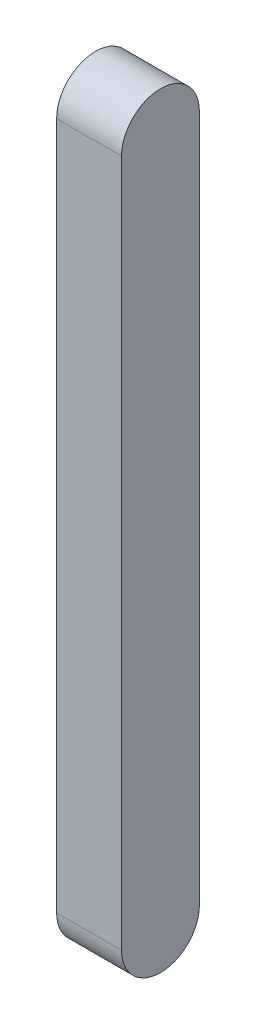
from build123d import *

# Parameters (mm, degrees)
EXTRUDE_1_DEPTH = 20


with BuildPart() as part:
    # 草图1 → 凸台-拉伸1 (new body)
    with BuildSketch(Plane(origin=(0, 0, 0), x_dir=(0, 0, -1), z_dir=(1, 0, 0))):
        with BuildLine():
            Line((12, 0), (12, -212))
            ThreePointArc((12, -212), (0, -224), (-12, -212))
            Line((-12, -212), (-12, 0))
            ThreePointArc((-12, 0), (0, 12), (12, 0))
        make_face()
    extrude(amount=EXTRUDE_1_DEPTH)


solid = part.part
